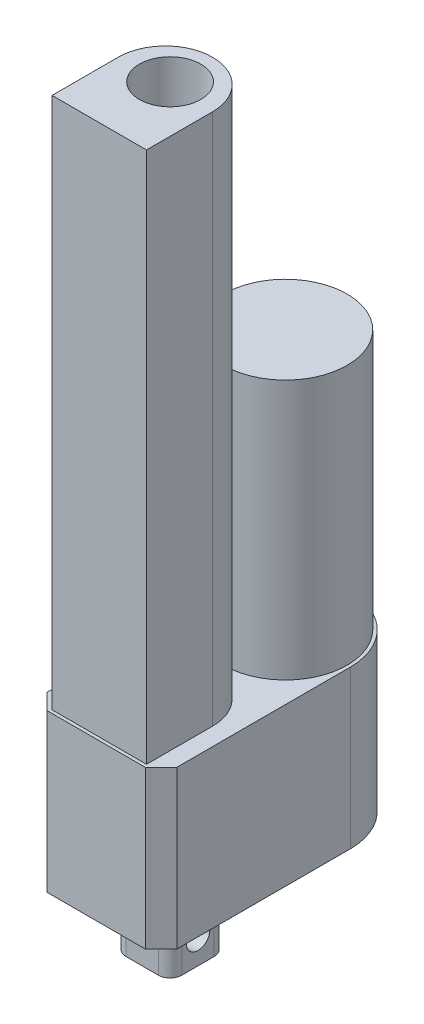
from build123d import *

# Parameters (mm, degrees)
BOSS_EXTRUDE1_DEPTH = 50.8
SKETCH2_R           = 19.939
BOSS_EXTRUDE2_DEPTH = 83.82
BOSS_EXTRUDE3_DEPTH = 171.704
BOSS_EXTRUDE4_DEPTH = 20.066
SKETCH5_R           = 3.81
CUT_EXTRUDE1_DEPTH  = 20.066
SKETCH6_R           = 9.906
CUT_EXTRUDE2_DEPTH  = 127


with BuildPart() as part:
    # Sketch1 → Boss-Extrude1 (new body)
    with BuildSketch(Plane(origin=(0, 0, 0), x_dir=(1, 0, 0), z_dir=(0, 1, 0))):
        with BuildLine():
            Line((-50.83623546, -27.655683544), (-45.75623546, -32.735683544))
            Line((-45.75623546, -32.735683544), (-14.00623546, -32.735683544))
            Line((-14.00623546, -32.735683544), (-8.92623546, -27.655683544))
            Line((-8.92623546, -27.655683544), (-8.92623546, 28.376716456))
            ThreePointArc((-8.92623546, 28.376716456), (-15.056373373, 43.176178544), (-29.85583546, 49.306316456))
            Line((-29.85583546, 49.306316456), (-29.90663546, 49.306316456))
            ThreePointArc((-29.90663546, 49.306316456), (-44.706097548, 43.176178544), (-50.83623546, 28.376716456))
            Line((-50.83623546, 28.376716456), (-50.83623546, -27.655683544))
        make_face()
    extrude(amount=BOSS_EXTRUDE1_DEPTH)

    # Sketch2 → Boss-Extrude2 (add)
    with BuildSketch(Plane(origin=(0, 50.8, 0), x_dir=(1, 0, 0), z_dir=(0, 1, 0))):
        with Locations(Location((-29.88123546, 28.351316456, 0), (0, 0, 270))):
            Circle(SKETCH2_R)
    extrude(amount=BOSS_EXTRUDE2_DEPTH)

    # Sketch3 → Boss-Extrude3 (add)
    with BuildSketch(Plane(origin=(0, 50.8, 0), x_dir=(1, 0, 0), z_dir=(0, 1, 0))):
        with BuildLine():
            Line((-45.12123546, -31.707852889), (-14.64123546, -31.707852889))
            Line((-14.64123546, -31.707852889), (-14.64123546, -10.371852889))
            ThreePointArc((-14.64123546, -10.371852889), (-29.88123546, 4.868147111), (-45.12123546, -10.371852889))
            Line((-45.12123546, -10.371852889), (-45.12123546, -31.707852889))
        make_face()
    extrude(amount=BOSS_EXTRUDE3_DEPTH)

    # Sketch4 → Boss-Extrude4 (add)
    with BuildSketch(Plane(origin=(0, 0, 0), x_dir=(-1, 0, 0), z_dir=(0, -1, 0))):
        with BuildLine():
            Line((24.67423546, 0.157316456), (35.08823546, 0.157316456))
            ThreePointArc((35.08823546, 0.157316456), (37.782312297, -0.958606708), (38.89823546, -3.652683544))
            Line((38.89823546, -3.652683544), (38.89823546, -14.066683544))
            ThreePointArc((38.89823546, -14.066683544), (37.782312297, -16.76076038), (35.08823546, -17.876683544))
            Line((35.08823546, -17.876683544), (24.67423546, -17.876683544))
            ThreePointArc((24.67423546, -17.876683544), (21.980158624, -16.76076038), (20.86423546, -14.066683544))
            Line((20.86423546, -14.066683544), (20.86423546, -3.652683544))
            ThreePointArc((20.86423546, -3.652683544), (21.980158624, -0.958606708), (24.67423546, 0.157316456))
        make_face()
    extrude(amount=BOSS_EXTRUDE4_DEPTH)

    # Sketch5 → Cut-Extrude1 (cut)
    with BuildSketch(Plane.ZY.offset(38.89823546)):
        with Locations((8.859683544, -11.938)):
            Circle(SKETCH5_R)
    extrude(amount=-CUT_EXTRUDE1_DEPTH, mode=Mode.SUBTRACT)

    # Sketch6 → Cut-Extrude2 (cut)
    with BuildSketch(Plane(origin=(0, 222.504, 0), x_dir=(1, 0, 0), z_dir=(0, 1, 0))):
        with Locations(Location((-29.88123546, -8.859683544, 0), (0, 0, 270))):
            Circle(SKETCH6_R)
    extrude(amount=-CUT_EXTRUDE2_DEPTH, mode=Mode.SUBTRACT)


solid = part.part
